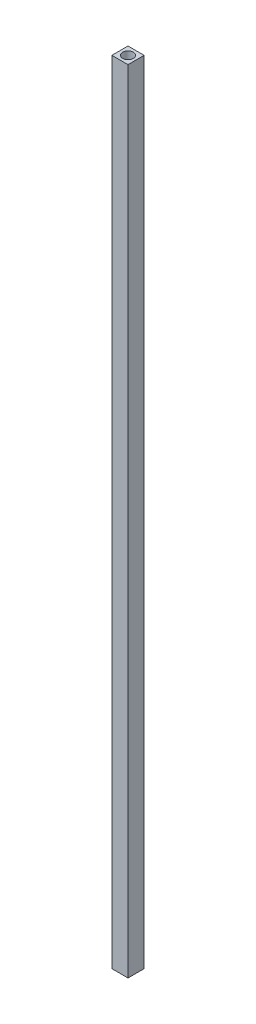
from build123d import *

# Parameters (mm, degrees)
SKETCH_1_W      = 3
SKETCH_1_H      = 3
SKETCH_1_R      = 1
EXTRUDE_1_DEPTH = 147


with BuildPart() as part:
    # 草图1 → 凸台-拉伸1 (new body)
    with BuildSketch(Plane(origin=(0, 0, 0), x_dir=(1, 0, 0), z_dir=(0, 1, 0))):
        with Locations((1.5, -1.5)):
            Rectangle(SKETCH_1_W, SKETCH_1_H)
        with Locations(Location((1.5, -1.5, 0), (0, 0, 270))):
            Circle(SKETCH_1_R, mode=Mode.SUBTRACT)
    extrude(amount=EXTRUDE_1_DEPTH)


solid = part.part
